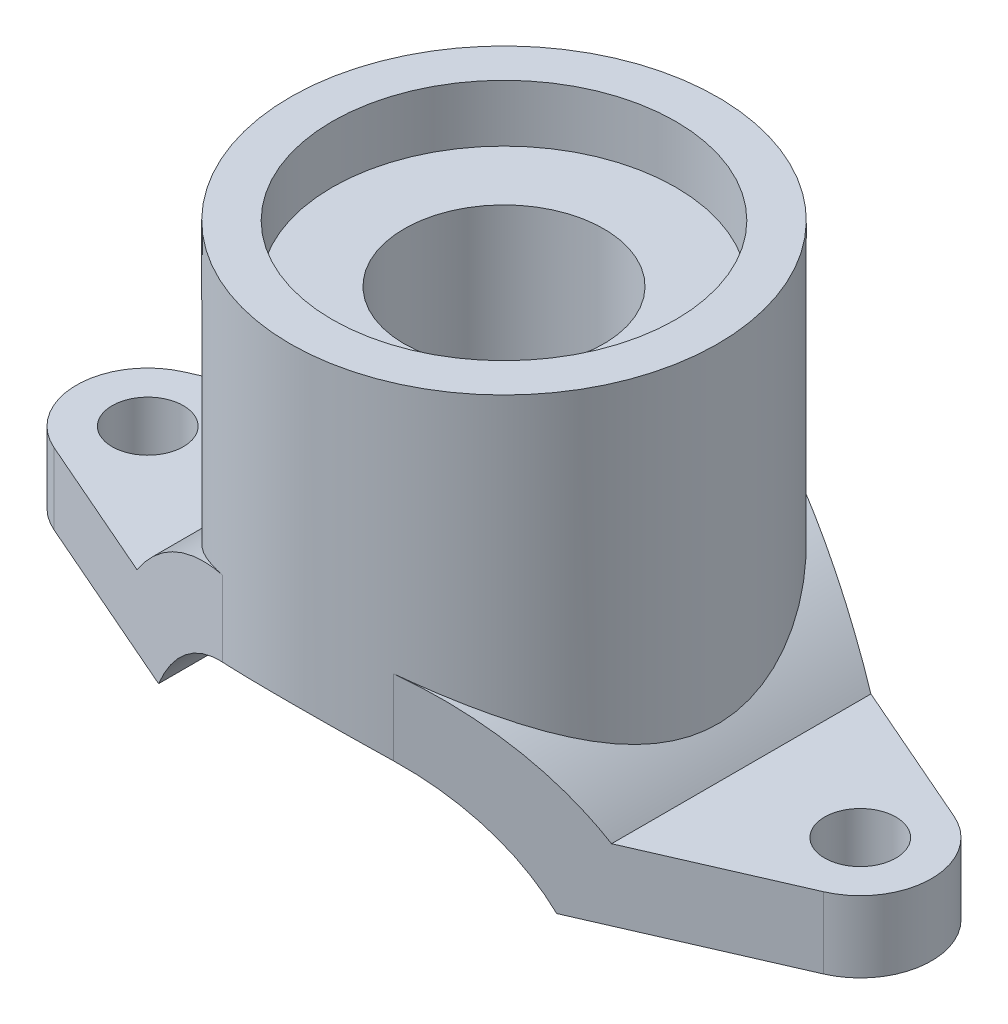
from build123d import *

# Parameters (mm, degrees)
BOSS_EXTRUDE2_DEPTH = 75
SKETCH2_OUTSIDE_W   = 370.368
SKETCH2_OUTSIDE_H   = 220.368
SKETCH2_OUTSIDE_R   = 12.5
CUT_EXTRUDE3_DEPTH  = 150
BOSS_EXTRUDE3_REACH = 227
SKETCH3_R           = 75


with BuildPart() as part:
    # Sketch1 → Boss-Extrude2 (new, symmetric)
    with BuildSketch(Plane.XY):
        with BuildLine():
            Line((150, 25), (83.240615087, 25))
            ThreePointArc((83.240615087, 25), (91.224995055, 12.990386393), (97.488460856, 0))
            Line((97.488460856, 0), (150, 0))
            Line((150, 0), (150, 25))
        make_face()
        with BuildLine():
            Line((-48, 25), (-83.240615087, 25))
            ThreePointArc((-83.240615087, 25), (-91.224995055, 12.990386393), (-97.488460856, 0))
            Line((-97.488460856, 0), (-69.84983894, 0))
            ThreePointArc((-69.84983894, 0), (-60.236169654, 13.646024213), (-48, 25))
        make_face()
        with BuildLine():
            ThreePointArc((97.488460856, 0), (91.224995055, 12.990386393), (83.240615087, 25))
            Line((83.240615087, 25), (48, 25))
            ThreePointArc((48, 25), (60.236169654, 13.646024213), (69.84983894, 0))
            Line((69.84983894, 0), (97.488460856, 0))
        make_face()
        with BuildLine():
            ThreePointArc((83.240615087, 25), (0, 66), (-83.240615087, 25))
            Line((-83.240615087, 25), (-48, 25))
            ThreePointArc((-48, 25), (0, 41), (48, 25))
            Line((48, 25), (83.240615087, 25))
        make_face()
        with BuildLine():
            Line((-48, 25), (-83.240615087, 25))
            ThreePointArc((-83.240615087, 25), (-91.224995055, 12.990386393), (-97.488460856, 0))
            Line((-97.488460856, 0), (-69.84983894, 0))
            ThreePointArc((-69.84983894, 0), (-60.236169654, 13.646024213), (-48, 25))
        make_face()
        with BuildLine():
            ThreePointArc((97.488460856, 0), (91.224995055, 12.990386393), (83.240615087, 25))
            Line((83.240615087, 25), (48, 25))
            ThreePointArc((48, 25), (60.236169654, 13.646024213), (69.84983894, 0))
            Line((69.84983894, 0), (97.488460856, 0))
        make_face()
        with BuildLine():
            Line((-83.240615087, 25), (-150, 25))
            Line((-150, 25), (-150, 0))
            Line((-150, 0), (-97.488460856, 0))
            ThreePointArc((-97.488460856, 0), (-91.224995055, 12.990386393), (-83.240615087, 25))
        make_face()
    extrude(amount=BOSS_EXTRUDE2_DEPTH, both=True)

    # Sketch2 outside → Cut-Extrude3 (cut)
    # profile 1 of 3: a face of its own
    with BuildSketch(Plane(origin=(0, 0, 0), x_dir=(1, 0, 0), z_dir=(0, 1, 0))):
        Rectangle(SKETCH2_OUTSIDE_W, SKETCH2_OUTSIDE_H)
        with BuildLine():
            Line((135, -22.912878475), (30, -68.738635424))
            ThreePointArc((30, -68.738635424), (0, -75), (-30, -68.738635424))
            Line((-30, -68.738635424), (-135, -22.912878475))
            ThreePointArc((-135, -22.912878475), (-150, 0), (-135, 22.912878475))
            Line((-135, 22.912878475), (-30, 68.738635424))
            ThreePointArc((-30, 68.738635424), (0, 75), (30, 68.738635424))
            Line((30, 68.738635424), (135, 22.912878475))
            ThreePointArc((135, 22.912878475), (150, 0), (135, -22.912878475))
        make_face(mode=Mode.SUBTRACT)
    # profile 2 of 3: a face of its own
    with BuildSketch(Plane(origin=(0, 0, 0), x_dir=(1, 0, 0), z_dir=(0, 1, 0))):
        with Locations(Location((125, 0, 0), (0, 0, 180))):
            Circle(SKETCH2_OUTSIDE_R)
    # profile 3 of 3: a face of its own
    with BuildSketch(Plane(origin=(0, 0, 0), x_dir=(1, 0, 0), z_dir=(0, 1, 0))):
        with Locations(Location((-125, 0, 0), (0, 0, 180))):
            Circle(SKETCH2_OUTSIDE_R)
    extrude(amount=CUT_EXTRUDE3_DEPTH, mode=Mode.SUBTRACT)

    # Sketch3 → Boss-Extrude3 (add, up to next)
    with BuildSketch(Plane(origin=(0, 150, 0), x_dir=(1, 0, 0), z_dir=(0, 1, 0)), mode=Mode.PRIVATE) as boss_extrude3_sk1:
        with Locations(Location((0, 0, 0), (0, 0, 113.578178478))):
            Circle(SKETCH3_R)
    boss_extrude3_tool1 = extrude(boss_extrude3_sk1.sketch, amount=-BOSS_EXTRUDE3_REACH, mode=Mode.PRIVATE) - part.part
    add(boss_extrude3_tool1.solids().sort_by_distance((0, 150, 0))[0])

    # Sketch5 → Cut-Revolve3 (revolve, cut)
    with BuildSketch(Plane.XY, mode=Mode.PRIVATE) as cut_revolve3_sk:
        Polygon((0, 150), (60.25406126, 150), (60.25406126, 130), (35, 130), (35, 0), (0, 0), align=None)
    revolve(cut_revolve3_sk.sketch.rotate(Axis((0, 0, 0), (0, -1, 0)), 90), axis=Axis((0, 0, 0), (0, -1, 0)), mode=Mode.SUBTRACT)


solid = part.part
